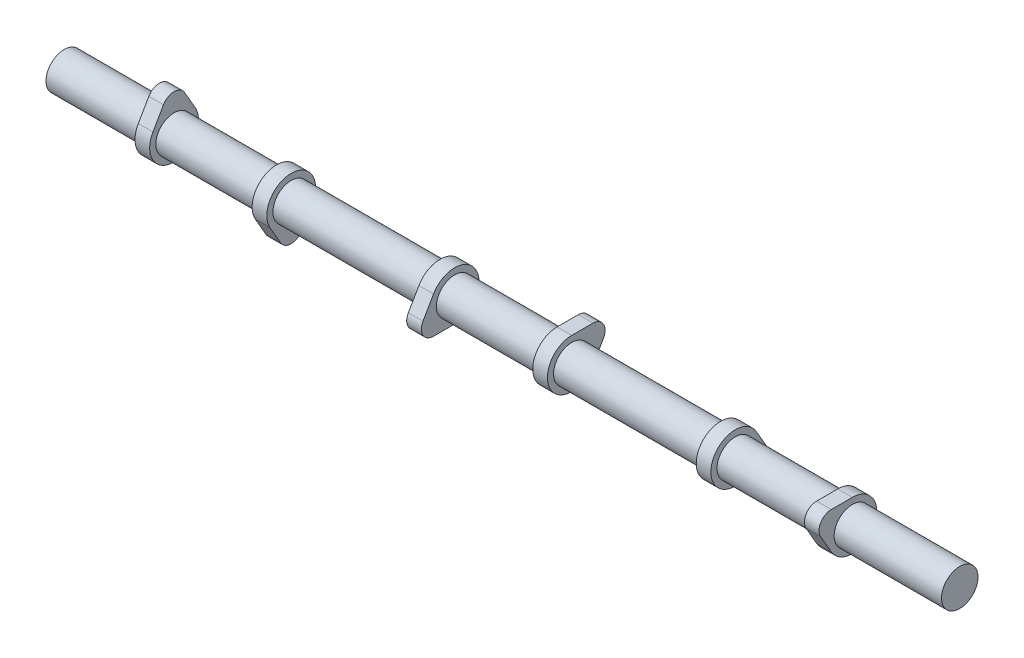
from build123d import *
from build123d.topology import SkipClean

# Parameters (mm, degrees)
BOSS_EXTRUDE1_DEPTH   = 3.81
BODY_MOVE_COPY2_ANGLE = 180
BOSS_EXTRUDE3_START   = -25.4
SKETCH2_R             = 9.5
BOSS_EXTRUDE3_DEPTH   = 146.05
LPATTERN1_COUNT       = 3
LPATTERN1_PITCH       = 146.05
BODY_MOVE_COPY3_ANGLE = 120
BODY_MOVE_COPY4_ANGLE = 120
BOSS_EXTRUDE4_START   = 27.94
SKETCH3_R             = 9.5
BOSS_EXTRUDE4_DEPTH   = 27.94


with BuildPart() as part:
    # Sketch1 → Boss-Extrude1 (new, symmetric)
    with BuildSketch(Plane(origin=(0, 0, 0), x_dir=(0, 0, -1), z_dir=(1, 0, 0))):
        with BuildLine():
            Line((-10.998522628, 6.35), (-5.499261314, 15.875))
            ThreePointArc((-5.499261314, 15.875), (0, 19.05), (5.499261314, 15.875))
            Line((5.499261314, 15.875), (10.998522628, 6.35))
            ThreePointArc((10.998522628, 6.35), (0, -12.7), (-10.998522628, 6.35))
        make_face()
    extrude(amount=BOSS_EXTRUDE1_DEPTH, both=True)


with BuildPart() as body_2:
    # Body-Move/Copy1: copy of part
    add(part.part.moved(Location((60.96, 0, 0))))


with BuildPart() as body_2_1:
    # Body-Move/Copy2: moved
    add(body_2.part.rotate(Axis((0, 0, 0), (1, 0, 0)), BODY_MOVE_COPY2_ANGLE))


with BuildPart() as part_1:
    add(part.part)

    add(body_2_1.part)  # Boss-Extrude3 merges body 2
    # Sketch2 → Boss-Extrude3 (add)
    with BuildSketch(Plane(origin=(0, 0, 0), x_dir=(0, 0, -1), z_dir=(1, 0, 0)).offset(BOSS_EXTRUDE3_START)):
        Circle(SKETCH2_R)
    extrude(amount=BOSS_EXTRUDE3_DEPTH)


with BuildPart() as lpattern1_1:
    # LPattern1: pattern copy
    add(part_1.part.moved(Location(Vector(1, 0, 0) * (1 * LPATTERN1_PITCH))))


with BuildPart() as lpattern1_2:
    # LPattern1: pattern copy
    add(part_1.part.moved(Location(Vector(1, 0, 0) * (2 * LPATTERN1_PITCH))))


with BuildPart() as lpattern1_1_1:
    # Body-Move/Copy3: moved
    add(lpattern1_1.part.rotate(Axis((0, 0, 0), (1, 0, 0)), BODY_MOVE_COPY3_ANGLE))


with BuildPart() as lpattern1_2_1:
    # Body-Move/Copy4: moved
    add(lpattern1_2.part.rotate(Axis((0, 0, 0), (-1, 0, 0)), BODY_MOVE_COPY4_ANGLE))


with BuildPart() as part_2:
    with SkipClean():  # the faces are left unmerged after this step: merging them gives an invalid solid
        add(part_1.part)

        # Sketch3 → Boss-Extrude4 (add)
        with BuildSketch(Plane.ZY.offset(25.4).offset(BOSS_EXTRUDE4_START)):
            with Locations(Location((0, 0, 0), (0, 0, 300))):
                Circle(SKETCH3_R)
        extrude(amount=-BOSS_EXTRUDE4_DEPTH)


with BuildPart() as lpattern1_1_2:
    add(lpattern1_1_1.part)

    # Combine1: union part, LPattern1_2
    add(part_2.part)
    add(lpattern1_2_1.part)


solid = lpattern1_1_2.part
